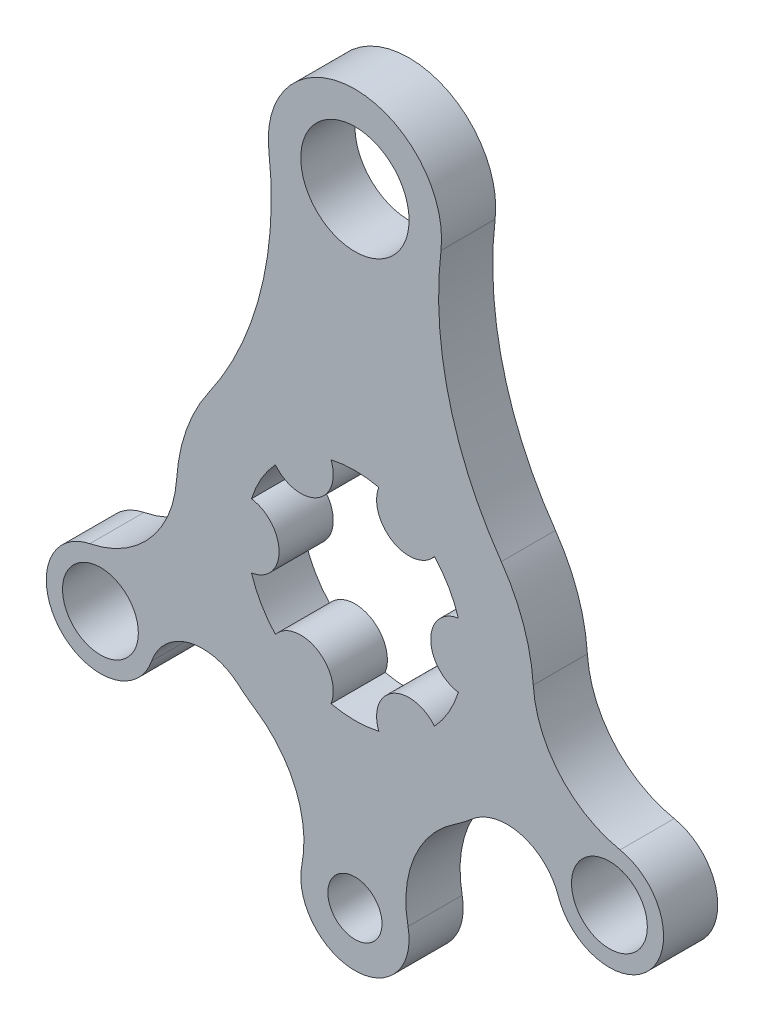
from build123d import *

# Parameters (mm, degrees)
SKETCH1_R           = 7
SKETCH1_R_2         = 5
SKETCH1_R_3         = 10
BOSS_EXTRUDE1_DEPTH = 5


with BuildPart() as part:
    # Sketch1 → Boss-Extrude1 (new, symmetric)
    with BuildSketch(Plane.XY):
        with BuildLine():
            ThreePointArc((27.029816197, 18.931165741), (17.392020832, 40.004906757), (15.890255583, 63.129230769))
            ThreePointArc((15.890255583, 63.129230769), (0, 81), (-15.890255583, 63.129230769))
            ThreePointArc((-15.890255583, 63.129230769), (-17.392020832, 40.004906757), (-27.029816197, 18.931165741))
            ThreePointArc((-27.029816197, 18.931165741), (-31.135684701, 10.934767406), (-32.931378534, 2.127042038))
            ThreePointArc((-32.931378534, 2.127042038), (-37.838433301, -9.754136505), (-48.963263256, -16.194613858))
            ThreePointArc((-48.963263256, -16.194613858), (-54.534765397, -32.574747935), (-37.550915036, -29.273345896))
            ThreePointArc((-37.550915036, -29.273345896), (-30.697148757, -22.889346352), (-21.566520754, -24.9776937))
            ThreePointArc((-21.566520754, -24.9776937), (-19.978209416, -26.265398313), (-18.313197236, -27.452264151))
            ThreePointArc((-18.313197236, -27.452264151), (-10.929939867, -36.447383635), (-9.804034884, -48.03))
            ThreePointArc((-9.804034884, -48.03), (0, -60), (9.804034884, -48.03))
            ThreePointArc((9.804034884, -48.03), (10.929939867, -36.447383635), (18.313197236, -27.452264151))
            ThreePointArc((18.313197236, -27.452264151), (19.978209416, -26.265398313), (21.566520754, -24.9776937))
            ThreePointArc((21.566520754, -24.9776937), (30.697148757, -22.889346352), (37.550915036, -29.273345896))
            ThreePointArc((37.550915036, -29.273345896), (54.534765397, -32.574747935), (48.963263256, -16.194613858))
            ThreePointArc((48.963263256, -16.194613858), (37.838433301, -9.754136505), (32.931378534, 2.127042038))
            ThreePointArc((32.931378534, 2.127042038), (31.135684701, 10.934767406), (27.029816197, 18.931165741))
        make_face()
        with Locations((-47, -26)):
            Circle(SKETCH1_R, mode=Mode.SUBTRACT)
        with BuildLine():
            ThreePointArc((-4.412636863, 19.507143202), (0, 20), (4.412636863, 19.507143202))
            ThreePointArc((4.412636863, 19.507143202), (7, 12.124355653), (14.687363137, 13.575027222))
            ThreePointArc((14.687363137, 13.575027222), (17.320508076, 10), (19.1, 5.93211598))
            ThreePointArc((19.1, 5.93211598), (14, 0), (19.1, -5.93211598))
            ThreePointArc((19.1, -5.93211598), (17.320508076, -10), (14.687363137, -13.575027222))
            ThreePointArc((14.687363137, -13.575027222), (7, -12.124355653), (4.412636863, -19.507143202))
            ThreePointArc((4.412636863, -19.507143202), (0, -20), (-4.412636863, -19.507143202))
            ThreePointArc((-4.412636863, -19.507143202), (-7, -12.124355653), (-14.687363137, -13.575027222))
            ThreePointArc((-14.687363137, -13.575027222), (-17.320508076, -10), (-19.1, -5.93211598))
            ThreePointArc((-19.1, -5.93211598), (-14, 0), (-19.1, 5.93211598))
            ThreePointArc((-19.1, 5.93211598), (-17.320508076, 10), (-14.687363137, 13.575027222))
            ThreePointArc((-14.687363137, 13.575027222), (-7, 12.124355653), (-4.412636863, 19.507143202))
        make_face(mode=Mode.SUBTRACT)
        with Locations((0, -50)):
            Circle(SKETCH1_R_2, mode=Mode.SUBTRACT)
        with Locations((47, -26)):
            Circle(SKETCH1_R, mode=Mode.SUBTRACT)
        with Locations((0, 65)):
            Circle(SKETCH1_R_3, mode=Mode.SUBTRACT)
    extrude(amount=BOSS_EXTRUDE1_DEPTH, both=True)


solid = part.part
